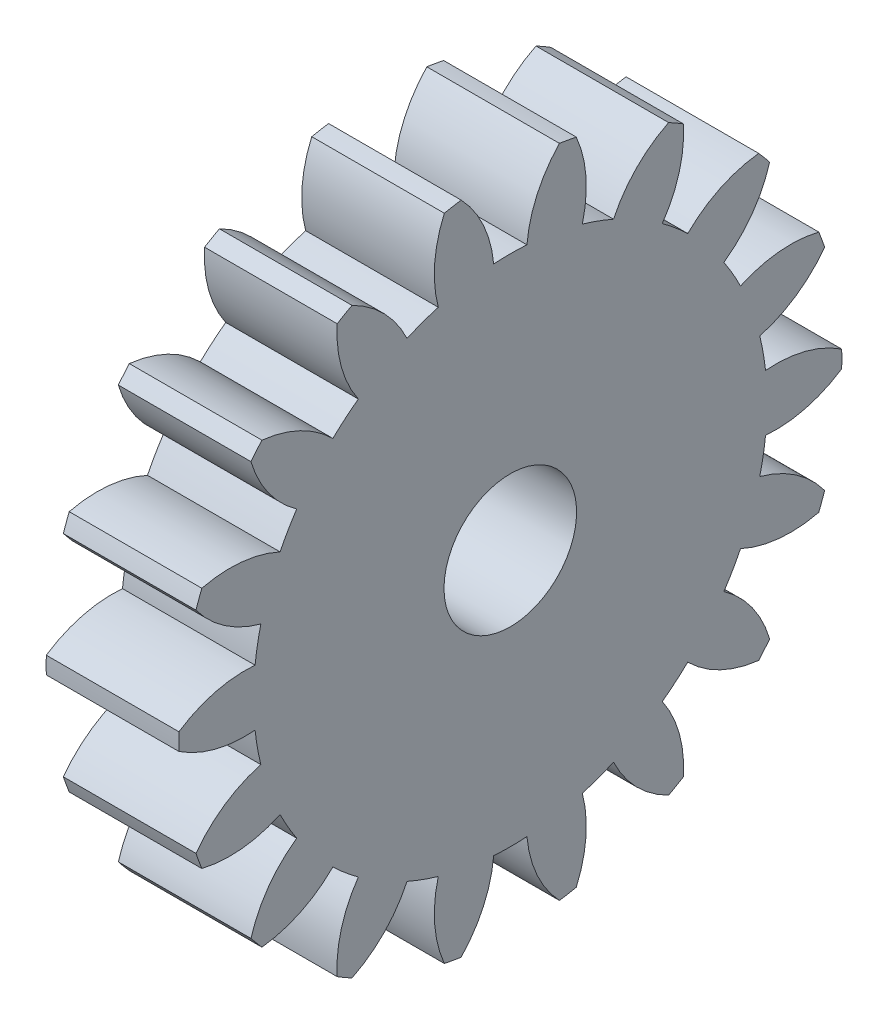
from build123d import *

# Parameters (mm, degrees)
BASPROSKE_W     = 1
BASPROSKE_H     = 2.5
TOOTHCUT_DEPTH  = 4.674234614
TEETHCUTS_COUNT = 18
TEETHCUTS_ANGLE = 340
BORSKE_R        = 0.5
BORE_DEPTH      = 50.0000508


with BuildPart() as part:
    # BasProSke → Base-Revolve (revolve)
    with BuildSketch(Plane(origin=(0, 0, 0), x_dir=(1, 0, 0), z_dir=(0, 1, 0)), mode=Mode.PRIVATE) as base_revolve_sk:
        with Locations((0.5, 1.25)):
            Rectangle(BASPROSKE_W, BASPROSKE_H)
    revolve(base_revolve_sk.sketch.rotate(Axis((-10, 0, 0), (1, 0, 0)), 180), axis=Axis((-10, 0, 0), (1, 0, 0)))

    # TooCutSke → ToothCut (cut, through all)
    with BuildSketch(Plane(origin=(0, 0, 0), x_dir=(0, 0, -1), z_dir=(1, 0, 0))):
        with BuildLine():
            ThreePointArc((0.125329644, 1.932440097), (0, 1.9365), (-0.125329644, 1.932440097))
            ThreePointArc((-0.125329644, 1.932440097), (-0.208776558, 2.237412457), (-0.39254911, 2.494704463))
            ThreePointArc((-0.39254911, 2.494704463), (0, 2.5254), (0.39254911, 2.494704463))
            ThreePointArc((0.39254911, 2.494704463), (0.208776558, 2.237412457), (0.125329644, 1.932440097))
        make_face()
    toothcut = extrude(amount=TOOTHCUT_DEPTH, mode=Mode.SUBTRACT)

    # TeethCuts: ToothCut ×18 about axis
    teethcuts_axis = Axis((-10, 0, 0), (1, 0, 0))
    for i in range(1, TEETHCUTS_COUNT):
        add(toothcut.rotate(teethcuts_axis, i * TEETHCUTS_ANGLE / (TEETHCUTS_COUNT - 1)), mode=Mode.SUBTRACT)

    # BorSke → Bore (cut, symmetric)
    with BuildSketch(Plane(origin=(0, 0, 0), x_dir=(0, 0, -1), z_dir=(1, 0, 0))):
        with Locations(Location((0, 0, 0), (0, 0, 180))):
            Circle(BORSKE_R)
    extrude(amount=BORE_DEPTH, both=True, mode=Mode.SUBTRACT)


solid = part.part
